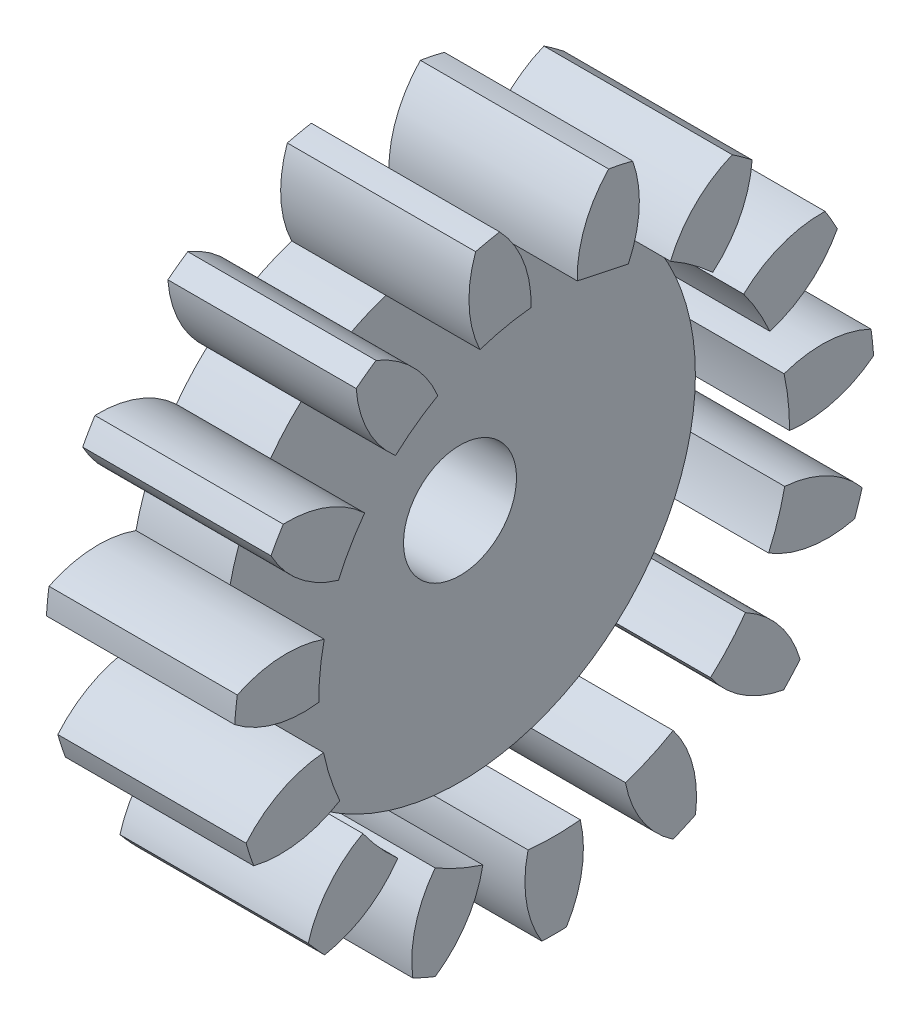
from build123d import *

# Parameters (mm, degrees)
BASPROSKE_W         = 5
BASPROSKE_H         = 17
TOOTHCUT_DEPTH      = 25.556058316
TEETHCUTS_COUNT     = 15
TEETHCUTS_ANGLE     = 336
BORSKE_R            = 3
BORE_DEPTH          = 50.0000508
BOSS_EXTRUDE1_START = 5
BOSS_EXTRUDE1_DEPTH = 5


with BuildPart() as part:
    # BasProSke → Base-Revolve (revolve)
    with BuildSketch(Plane(origin=(0, 0, 0), x_dir=(1, 0, 0), z_dir=(0, 1, 0)), mode=Mode.PRIVATE) as base_revolve_sk:
        with Locations((2.5, 8.5)):
            Rectangle(BASPROSKE_W, BASPROSKE_H)
    revolve(base_revolve_sk.sketch.rotate(Axis((-10, 0, 0), (1, 0, 0)), 180), axis=Axis((-10, 0, 0), (1, 0, 0)))

    # TooCutSke → ToothCut (cut, through all)
    with BuildSketch(Plane(origin=(0, 0, 0), x_dir=(0, 0, -1), z_dir=(1, 0, 0))):
        with BuildLine():
            ThreePointArc((1.225947666, 12.438731982), (0, 12.499), (-1.225947666, 12.438731982))
            ThreePointArc((-1.225947666, 12.438731982), (-1.633372372, 14.776760457), (-2.915451202, 16.773919919))
            ThreePointArc((-2.915451202, 16.773919919), (0, 17.0254), (2.915451202, 16.773919919))
            ThreePointArc((2.915451202, 16.773919919), (1.633372372, 14.776760457), (1.225947666, 12.438731982))
        make_face()
    toothcut = extrude(amount=TOOTHCUT_DEPTH, mode=Mode.SUBTRACT)

    # TeethCuts: ToothCut ×15 about axis
    teethcuts_axis = Axis((-10, 0, 0), (1, 0, 0))
    for i in range(1, TEETHCUTS_COUNT):
        add(toothcut.rotate(teethcuts_axis, i * TEETHCUTS_ANGLE / (TEETHCUTS_COUNT - 1)), mode=Mode.SUBTRACT)

    # BorSke → Bore (cut, symmetric)
    with BuildSketch(Plane(origin=(0, 0, 0), x_dir=(0, 0, -1), z_dir=(1, 0, 0))):
        with Locations(Location((0, 0, 0), (0, 0, 180))):
            Circle(BORSKE_R)
    extrude(amount=BORE_DEPTH, both=True, mode=Mode.SUBTRACT)

    # Sketch1 → Boss-Extrude1 (add)
    with BuildSketch(Plane(origin=(5, 0, 0), x_dir=(0, 0, -1), z_dir=(1, 0, 0)).offset(BOSS_EXTRUDE1_START)):
        with BuildLine():
            ThreePointArc((9.457523559, 14.126402519), (7.491877309, 12.824438373), (6.179632418, 10.865640486))
            ThreePointArc((6.179632418, 10.865640486), (7.347315654, 10.11271243), (8.424226752, 9.234847245))
            ThreePointArc((8.424226752, 9.234847245), (9.881648274, 11.088168135), (10.512471663, 13.359937857))
            ThreePointArc((10.512471663, 13.359937857), (9.992349289, 13.753288904), (9.457523559, 14.126402519))
        make_face()
        with BuildLine():
            ThreePointArc((14.385603227, 9.05838947), (12.060339498, 8.668486395), (10.064829262, 7.412773565))
            ThreePointArc((10.064829262, 7.412773565), (10.825317547, 6.25), (11.452064851, 5.010011043))
            ThreePointArc((11.452064851, 5.010011043), (13.53729918, 6.110317186), (15.037597012, 7.929103109))
            ThreePointArc((15.037597012, 7.929103109), (14.722431864, 8.5), (14.385603227, 9.05838947))
        make_face()
        with BuildLine():
            ThreePointArc((16.826281408, 2.424098589), (14.543459423, 3.013674369), (12.20972569, 2.678170752))
            ThreePointArc((12.20972569, 2.678170752), (12.427219543, 1.346927778), (12.5, 0))
            ThreePointArc((12.5, 0), (12.499934224, -0.040551005), (12.499736899, -0.081101583))
            ThreePointArc((12.499736899, -0.081101583), (14.852228075, 0.075936885), (16.962585225, 1.127254399))
            ThreePointArc((16.962585225, 1.127254399), (16.906872221, 1.776983876), (16.826281408, 2.424098589))
        make_face()
        with BuildLine():
            ThreePointArc((16.357542672, -4.629340961), (14.511883091, -3.162229334), (12.243449624, -2.519512115))
            ThreePointArc((12.243449624, -2.519512115), (11.888206454, -3.86271243), (11.38609088, -5.158191008))
            ThreePointArc((11.38609088, -5.158191008), (13.599071808, -5.971573593), (15.954588353, -5.869506836))
            ThreePointArc((15.954588353, -5.869506836), (16.167960777, -5.253288904), (16.357542672, -4.629340961))
        make_face()
        with BuildLine():
            ThreePointArc((13.060436204, -10.882325402), (11.971070336, -8.791354857), (10.160169891, -7.281548448))
            ThreePointArc((10.160169891, -7.281548448), (9.289310318, -8.364132579), (8.303686309, -9.343382347))
            ThreePointArc((8.303686309, -9.343382347), (9.994512481, -10.986544747), (12.187898211, -11.851377017))
            ThreePointArc((12.187898211, -11.851377017), (12.633462033, -11.375220308), (13.060436204, -10.882325402))
        make_face()
        with BuildLine():
            ThreePointArc((7.505061666, -15.253656919), (7.360350766, -12.900375259), (6.32010448, -10.784538903))
            ThreePointArc((6.32010448, -10.784538903), (5.084208038, -11.419318221), (3.785498938, -11.913017997))
            ThreePointArc((3.785498938, -11.913017997), (4.661811149, -14.101842504), (6.313809745, -15.784036445))
            ThreePointArc((6.313809745, -15.784036445), (6.914522932, -15.53027278), (7.505061666, -15.253656919))
        make_face()
        with BuildLine():
            ThreePointArc((0.651993785, -16.987492579), (1.476959682, -14.778803582), (1.387235589, -12.422784608))
            ThreePointArc((1.387235589, -12.422784608), (0, -12.5), (-1.387235589, -12.422784608))
            ThreePointArc((-1.387235589, -12.422784608), (-1.476959682, -14.778803582), (-0.651993785, -16.987492579))
            ThreePointArc((-0.651993785, -16.987492579), (0, -17), (0.651993785, -16.987492579))
        make_face()
        with BuildLine():
            ThreePointArc((-3.785498938, -11.913017997), (-5.084208038, -11.419318221), (-6.32010448, -10.784538903))
            ThreePointArc((-6.32010448, -10.784538903), (-7.360350766, -12.900375259), (-7.505061666, -15.253656919))
            ThreePointArc((-7.505061666, -15.253656919), (-6.914522932, -15.53027278), (-6.313809745, -15.784036445))
            ThreePointArc((-6.313809745, -15.784036445), (-4.661811149, -14.101842504), (-3.785498938, -11.913017997))
        make_face()
        with BuildLine():
            ThreePointArc((-8.303686309, -9.343382347), (-9.289310318, -8.364132579), (-10.160169891, -7.281548448))
            ThreePointArc((-10.160169891, -7.281548448), (-11.971070336, -8.791354857), (-13.060436204, -10.882325402))
            ThreePointArc((-13.060436204, -10.882325402), (-12.633462033, -11.375220308), (-12.187898211, -11.851377017))
            ThreePointArc((-12.187898211, -11.851377017), (-9.994512481, -10.986544747), (-8.303686309, -9.343382347))
        make_face()
        with BuildLine():
            ThreePointArc((-11.38609088, -5.158191008), (-11.888206454, -3.86271243), (-12.243449624, -2.519512115))
            ThreePointArc((-12.243449624, -2.519512115), (-14.511883091, -3.162229334), (-16.357542672, -4.629340961))
            ThreePointArc((-16.357542672, -4.629340961), (-16.167960777, -5.253288904), (-15.954588353, -5.869506836))
            ThreePointArc((-15.954588353, -5.869506836), (-13.599071808, -5.971573593), (-11.38609088, -5.158191008))
        make_face()
        with BuildLine():
            ThreePointArc((-12.499736899, -0.081101583), (-12.431523692, 1.306605791), (-12.20972569, 2.678170752))
            ThreePointArc((-12.20972569, 2.678170752), (-14.543459423, 3.013674369), (-16.826281408, 2.424098589))
            ThreePointArc((-16.826281408, 2.424098589), (-16.906872221, 1.776983876), (-16.962585225, 1.127254399))
            ThreePointArc((-16.962585225, 1.127254399), (-14.852228075, 0.075936885), (-12.499736899, -0.081101583))
        make_face()
        with BuildLine():
            ThreePointArc((-11.452064851, 5.010011043), (-10.825317547, 6.25), (-10.064829262, 7.412773565))
            ThreePointArc((-10.064829262, 7.412773565), (-12.060339498, 8.668486395), (-14.385603227, 9.05838947))
            ThreePointArc((-14.385603227, 9.05838947), (-14.722431864, 8.5), (-15.037597012, 7.929103109))
            ThreePointArc((-15.037597012, 7.929103109), (-13.53729918, 6.110317186), (-11.452064851, 5.010011043))
        make_face()
        with BuildLine():
            ThreePointArc((-8.424226752, 9.234847245), (-7.347315654, 10.11271243), (-6.179632418, 10.865640486))
            ThreePointArc((-6.179632418, 10.865640486), (-7.491877309, 12.824438373), (-9.457523559, 14.126402519))
            ThreePointArc((-9.457523559, 14.126402519), (-9.992349289, 13.753288904), (-10.512471663, 13.359937857))
            ThreePointArc((-10.512471663, 13.359937857), (-9.881648274, 11.088168135), (-8.424226752, 9.234847245))
        make_face()
        with BuildLine():
            ThreePointArc((-3.939763316, 11.862894462), (-2.598896135, 12.226845009), (-1.225920989, 12.439739456))
            ThreePointArc((-1.225920989, 12.439739456), (-1.628001472, 14.76292845), (-2.894152149, 16.751832238))
            ThreePointArc((-2.894152149, 16.751832238), (-3.534498744, 16.628509212), (-4.169644461, 16.480717978))
            ThreePointArc((-4.169644461, 16.480717978), (-4.51737061, 14.14877408), (-3.939763316, 11.862894462))
        make_face()
        with BuildLine():
            Line((1.225947666, 12.438731982), (3.939329169, 11.861984939))
            ThreePointArc((3.939329169, 11.861984939), (4.517345534, 14.148270791), (4.169644461, 16.480717978))
            ThreePointArc((4.169644461, 16.480717978), (3.534498744, 16.628509212), (2.894152149, 16.751832238))
            ThreePointArc((2.894152149, 16.751832238), (1.627819674, 14.762458473), (1.225947666, 12.438731982))
        make_face()
    extrude(amount=-BOSS_EXTRUDE1_DEPTH)


solid = part.part
